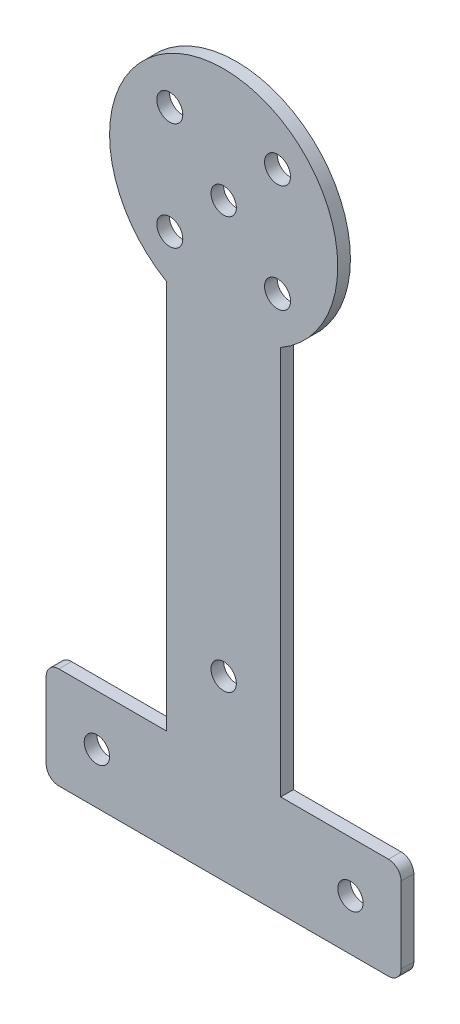
from build123d import *

# Parameters (mm, degrees)
SKETCH_1_R      = 2
SKETCH_1_R_2    = 2.05
EXTRUDE_1_DEPTH = 2
FILLET_1_R      = 2


with BuildPart() as part:
    # 草图1 → 凸台-拉伸1 (new body)
    with BuildSketch(Plane.XY):
        with BuildLine():
            Line((14.659550972, 19.565520938), (14.659550972, 35.565520938))
            Line((14.659550972, 35.565520938), (-4.340449028, 35.565520938))
            Line((-4.340449028, 35.565520938), (-4.340449028, 96.97706367))
            ThreePointArc((-4.340449028, 96.97706367), (-13.340449028, 130.565520938), (-22.340449028, 96.97706367))
            Line((-22.340449028, 96.97706367), (-22.340449028, 35.565520938))
            Line((-22.340449028, 35.565520938), (-41.340449028, 35.565520938))
            Line((-41.340449028, 35.565520938), (-41.340449028, 19.565520938))
            Line((-41.340449028, 19.565520938), (14.659550972, 19.565520938))
        make_face()
        with Locations((-33.340449028, 27.565520938)):
            Circle(SKETCH_1_R, mode=Mode.SUBTRACT)
        with Locations(Location((6.659550972, 27.565520938, 0), (0, 0, 180))):
            Circle(SKETCH_1_R, mode=Mode.SUBTRACT)
        with Locations((-13.340449028, 112.565520938)):
            Circle(SKETCH_1_R, mode=Mode.SUBTRACT)
        with Locations((-13.340449028, 47.565520938)):
            Circle(SKETCH_1_R, mode=Mode.SUBTRACT)
        with Locations((-4.840449028, 121.065520938)):
            Circle(SKETCH_1_R_2, mode=Mode.SUBTRACT)
        with Locations((-4.840449028, 104.065520938)):
            Circle(SKETCH_1_R_2, mode=Mode.SUBTRACT)
        with Locations((-21.840449028, 104.065520938)):
            Circle(SKETCH_1_R_2, mode=Mode.SUBTRACT)
        with Locations((-21.840449028, 121.065520938)):
            Circle(SKETCH_1_R_2, mode=Mode.SUBTRACT)
    extrude(amount=EXTRUDE_1_DEPTH)

    # 圆角1
    fillet_1_edges = [part.edges().sort_by_distance(p)[0] for p in [
        (-41.340449028, 19.565520938, 1),
        (-41.340449028, 35.565520938, 1),
        (14.659550972, 35.565520938, 1),
        (14.659550972, 19.565520938, 1),
    ]]
    fillet(fillet_1_edges, radius=FILLET_1_R)


solid = part.part
